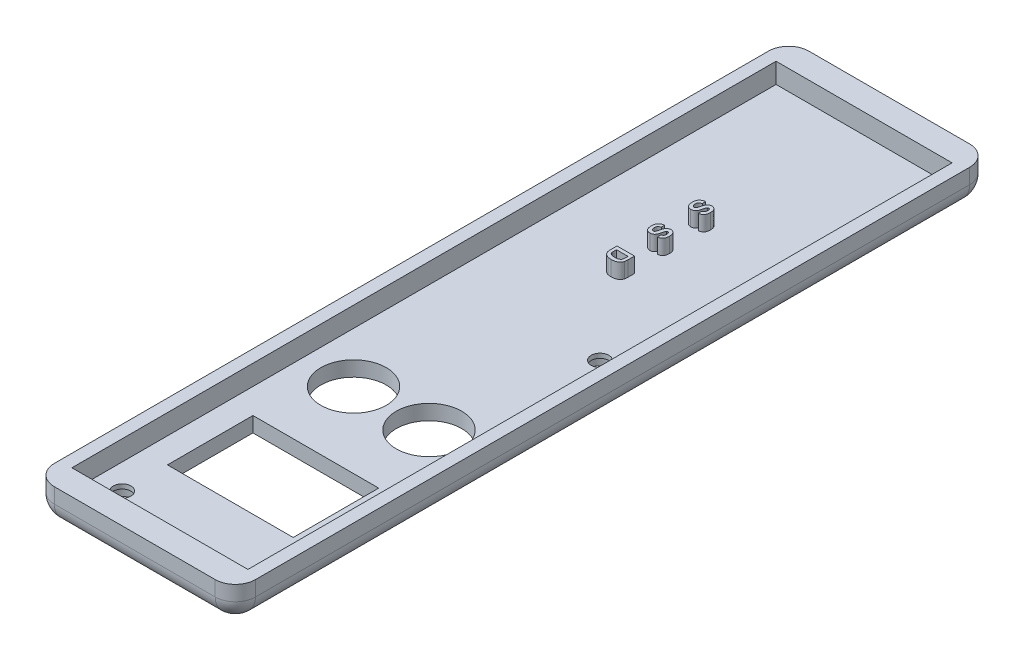
from build123d import *

# Parameters (mm, degrees)
SKETCH1_W           = 40
SKETCH1_H           = 150
BOSS_EXTRUDE1_DEPTH = 3
SKETCH2_W           = 40
SKETCH2_H           = 150
SKETCH2_W_2         = 35
SKETCH2_H_2         = 140
BOSS_EXTRUDE2_DEPTH = 4
FILLET6_R           = 4
CUT_EXTRUDE1_REACH  = 79.936
SKETCH5_R           = 6.5
SKETCH5_W           = 25
SKETCH5_H           = 17
SKETCH7_R           = 2.9
CUT_EXTRUDE7_DEPTH  = 2.1
CUT_EXTRUDE8_REACH  = 79.775
SKETCH8_R           = 1.75
CUT_EXTRUDE9_REACH  = 79.775
SKETCH9_R           = 1.75
BOSS_EXTRUDE3_DEPTH = 3


with BuildPart() as part:
    # Sketch1 → Boss-Extrude1 (new body)
    with BuildSketch(Plane(origin=(0, 0, 0), x_dir=(1, 0, 0), z_dir=(0, 1, 0))):
        Rectangle(SKETCH1_W, SKETCH1_H)
    extrude(amount=BOSS_EXTRUDE1_DEPTH)

    # Sketch2 → Boss-Extrude2 (add)
    with BuildSketch(Plane(origin=(0, 3, 0), x_dir=(1, 0, 0), z_dir=(0, 1, 0))):
        Rectangle(SKETCH2_W, SKETCH2_H)
        Rectangle(SKETCH2_W_2, SKETCH2_H_2, mode=Mode.SUBTRACT)
    extrude(amount=BOSS_EXTRUDE2_DEPTH)

    # Fillet6
    fillet6_edges = [part.edges().sort_by_distance(p)[0] for p in [
        (0, 0, 75),
        (-20, 0, 0),
        (0, 0, -75),
        (20, 0, 0),
        (20, 3.5, 75),
        (-20, 3.5, 75),
        (-20, 3.5, -75),
        (20, 3.5, -75),
    ]]
    fillet(fillet6_edges, radius=FILLET6_R)

    # Sketch5 → Cut-Extrude1 (cut, up to next)
    with BuildSketch(Plane.XZ, mode=Mode.PRIVATE) as cut_extrude1_sk1:
        with Locations(Location((-7.5, 24, 0), (0, 0, 270))):
            Circle(SKETCH5_R)
    cut_extrude1_tool1 = extrude(cut_extrude1_sk1.sketch, amount=-CUT_EXTRUDE1_REACH, mode=Mode.PRIVATE) & part.part
    # Sketch5 → Cut-Extrude1 (cut, up to next)
    with BuildSketch(Plane.XZ, mode=Mode.PRIVATE) as cut_extrude1_sk2:
        with Locations(Location((7.5, 24, 0), (0, 0, 270))):
            Circle(SKETCH5_R)
    cut_extrude1_tool2 = extrude(cut_extrude1_sk2.sketch, amount=-CUT_EXTRUDE1_REACH, mode=Mode.PRIVATE) & part.part
    # Sketch5 → Cut-Extrude1 (cut, up to next)
    with BuildSketch(Plane.XZ, mode=Mode.PRIVATE) as cut_extrude1_sk3:
        with Locations((0, 47.5)):
            Rectangle(SKETCH5_W, SKETCH5_H)
    cut_extrude1_tool3 = extrude(cut_extrude1_sk3.sketch, amount=-CUT_EXTRUDE1_REACH, mode=Mode.PRIVATE) & part.part
    add(cut_extrude1_tool1.solids().sort_by_distance((-7.5, 0, 24))[0], mode=Mode.SUBTRACT)
    add(cut_extrude1_tool2.solids().sort_by_distance((7.5, 0, 24))[0], mode=Mode.SUBTRACT)
    add(cut_extrude1_tool3.solids().sort_by_distance((0, 0, 47.5))[0], mode=Mode.SUBTRACT)

    # Sketch7 → Cut-Extrude7 (cut)
    with BuildSketch(Plane.XZ):
        with Locations(Location((-12.5, 65, 0), (0, 0, 270))):
            Circle(SKETCH7_R)
        with Locations(Location((12.5, -5, 0), (0, 0, 270))):
            Circle(SKETCH7_R)
    extrude(amount=-CUT_EXTRUDE7_DEPTH, mode=Mode.SUBTRACT)

    # Sketch8 → Cut-Extrude8 (cut, up to next)
    with BuildSketch(Plane.XZ.offset(-2.1), mode=Mode.PRIVATE) as cut_extrude8_sk1:
        with Locations(Location((-12.5, 65, 0), (0, 0, 270))):
            Circle(SKETCH8_R)
    cut_extrude8_tool1 = extrude(cut_extrude8_sk1.sketch, amount=-CUT_EXTRUDE8_REACH, mode=Mode.PRIVATE) & part.part
    add(cut_extrude8_tool1.solids().sort_by_distance((-12.5, 2.1, 65))[0], mode=Mode.SUBTRACT)

    # Sketch9 → Cut-Extrude9 (cut, up to next)
    with BuildSketch(Plane.XZ.offset(-2.1), mode=Mode.PRIVATE) as cut_extrude9_sk1:
        with Locations(Location((12.5, -5, 0), (0, 0, 270))):
            Circle(SKETCH9_R)
    cut_extrude9_tool1 = extrude(cut_extrude9_sk1.sketch, amount=-CUT_EXTRUDE9_REACH, mode=Mode.PRIVATE) & part.part
    add(cut_extrude9_tool1.solids().sort_by_distance((12.5, 2.1, -5))[0], mode=Mode.SUBTRACT)

    # Sketch10 → Boss-Extrude3 (add)
    # profile 1 of 3: a face of its own
    with BuildSketch(Plane(origin=(0, 3, 0), x_dir=(1, 0, 0), z_dir=(0, 1, 0))):
        with BuildLine():
            Line((-1.37119391, 39.826822917), (-1.303886218, 39.145332532))
            add(Edge.make_bspline(
                [(-1.303886218, 39.145332532), (-1.331557228, 39.139888819), (-1.385446064, 39.129287278), (-1.462594555, 39.107174228), (-1.534505186, 39.082263778), (-1.600689414, 39.052776819), (-1.661028723, 39.019257221), (-1.715691708, 38.981651855), (-1.764828161, 38.940594367), (-1.808051209, 38.894990303), (-1.846267894, 38.845890332), (-1.878313327, 38.792170952), (-1.906162345, 38.734824179), (-1.92821249, 38.673142381), (-1.946012021, 38.607288458), (-1.958215678, 38.53735479), (-1.96638591, 38.463335056), (-1.966889359, 38.412683553), (-1.967147436, 38.38671875)],
                knots=[0, 0, 0, 0, 1.211294388, 2.358975799, 3.445216481, 4.479134408, 5.468186123, 6.406912785, 7.326263151, 8.214140934, 9.101961924, 9.994088899, 10.89689099, 11.837227727, 12.804317251, 13.824685958, 14.884897803, 16, 16, 16, 16], degree=3))
            add(Edge.make_bspline(
                [(-1.967147436, 38.38671875), (-1.966847327, 38.35935579), (-1.966266548, 38.306402198), (-1.958861689, 38.22962416), (-1.94809058, 38.15781873), (-1.931948858, 38.091249535), (-1.911599241, 38.029773588), (-1.887213982, 37.973539216), (-1.858350031, 37.922316168), (-1.824669757, 37.877065707), (-1.788010302, 37.83691665), (-1.749644217, 37.802078075), (-1.710091389, 37.771917786), (-1.668563029, 37.748015615), (-1.625381531, 37.729775445), (-1.580828232, 37.716065409), (-1.534581741, 37.708459477), (-1.503263604, 37.707240865), (-1.487580128, 37.706630609)],
                knots=[0, 0, 0, 0, 1.412338723, 2.733198818, 3.979115176, 5.158628644, 6.265273535, 7.319005634, 8.318845747, 9.293910864, 10.22497206, 11.12193898, 11.966650322, 12.788379738, 13.58856126, 14.382622932, 15.190050982, 16, 16, 16, 16], degree=3))
            add(Edge.make_bspline(
                [(-1.487580128, 37.706630609), (-1.467851314, 37.707266749), (-1.429258312, 37.70851115), (-1.374067599, 37.723296234), (-1.323139237, 37.745902048), (-1.276317281, 37.778436463), (-1.233043151, 37.822526687), (-1.195471281, 37.880713785), (-1.158230837, 37.950459241), (-1.138913682, 38.003139208), (-1.128605769, 38.03125)],
                knots=[0, 0, 0, 0, 0.904415498, 1.7691945, 2.605565634, 3.454596817, 4.373498053, 5.42498127, 6.625932802, 8, 8, 8, 8], degree=3))
            add(Edge.make_bspline(
                [(-1.128605769, 38.03125), (-1.124523867, 38.043135114), (-1.115299982, 38.069991939), (-1.102626146, 38.115911937), (-1.08596563, 38.17101275), (-1.068887337, 38.236414991), (-1.049140665, 38.311402325), (-1.027476022, 38.396258424), (-1.003627768, 38.490907536), (-0.987187599, 38.557318713), (-0.978565705, 38.592147436)],
                knots=[0, 0, 0, 0, 0.519212209, 1.173265296, 1.967941684, 2.898041418, 3.966265741, 5.172651249, 6.517223256, 8, 8, 8, 8], degree=3))
            add(Edge.make_bspline(
                [(-0.978565705, 38.592147436), (-0.967042438, 38.637597766), (-0.944833523, 38.725194673), (-0.906281511, 38.850264195), (-0.86807547, 38.965448386), (-0.825288734, 39.069361122), (-0.782619091, 39.163881299), (-0.736247488, 39.247050872), (-0.688849112, 39.320504591), (-0.653418814, 39.363218499), (-0.636418269, 39.383713942)],
                knots=[0, 0, 0, 0, 1.293515956, 2.493007092, 3.610516328, 4.640340647, 5.592450897, 6.469945202, 7.265832759, 8, 8, 8, 8], degree=3))
            add(Edge.make_bspline(
                [(-0.636418269, 39.383713942), (-0.612383869, 39.409240168), (-0.56535905, 39.459183839), (-0.487362289, 39.524118971), (-0.405467853, 39.579039504), (-0.320157661, 39.625252056), (-0.229857603, 39.659466091), (-0.136451726, 39.684782307), (-0.038916895, 39.700914971), (0.027481169, 39.702579989), (0.061197917, 39.703425481)],
                knots=[0, 0, 0, 0, 1.062123294, 2.078111211, 3.068480182, 4.047865808, 5.012299681, 5.988502474, 6.978567294, 8, 8, 8, 8], degree=3))
            add(Edge.make_bspline(
                [(0.061197917, 39.703425481), (0.104826213, 39.701767139), (0.191600116, 39.698468802), (0.318875525, 39.668971791), (0.442097014, 39.622373559), (0.539058118, 39.56730693), (0.613496019, 39.515649609), (0.666222195, 39.471981027), (0.715437803, 39.424146959), (0.761185449, 39.372117544), (0.803174086, 39.315584477), (0.84276426, 39.255566203), (0.877519987, 39.190428269), (0.921294721, 39.097814295), (0.966170758, 38.971273942), (1.003208917, 38.806991757), (1.026948515, 38.628358358), (1.029516672, 38.504353519), (1.030849359, 38.440004006)],
                knots=[0, 0, 0, 0, 1.169949165, 2.326954425, 3.488798779, 4.696747735, 5.309491634, 5.920079168, 6.532437411, 7.150459684, 7.777933887, 8.42188263, 9.078905351, 9.758202326, 11.171343328, 12.67210894, 14.273066053, 16, 16, 16, 16], degree=3))
            add(Edge.make_bspline(
                [(1.030849359, 38.440004006), (1.030169176, 38.387153999), (1.028851611, 38.284779537), (1.015104643, 38.136313196), (0.993850424, 37.997743333), (0.963520387, 37.868936415), (0.922538221, 37.750561109), (0.873424996, 37.64203007), (0.816260689, 37.542717645), (0.748177712, 37.455177468), (0.673757055, 37.376841672), (0.59269854, 37.30869837), (0.506138813, 37.24962245), (0.412376125, 37.202274712), (0.313668824, 37.162393844), (0.208399917, 37.13408872), (0.09761975, 37.114598624), (0.021548728, 37.11014741), (-0.017327724, 37.107872596)],
                knots=[0, 0, 0, 0, 1.327349245, 2.571175932, 3.742026754, 4.847068536, 5.890550229, 6.883730842, 7.836307007, 8.761661861, 9.662784209, 10.54607647, 11.417266113, 12.28904906, 13.179783262, 14.087100406, 15.022403705, 16, 16, 16, 16], degree=3))
            Line((-0.017327724, 37.107872596), (-0.049579327, 37.808293269))
            add(Edge.make_bspline(
                [(-0.049579327, 37.808293269), (-0.028010199, 37.812442601), (0.013776926, 37.820481341), (0.073614807, 37.836989141), (0.12943345, 37.855171405), (0.179539, 37.878931385), (0.226108384, 37.903622473), (0.266648705, 37.933673411), (0.303382519, 37.965704609), (0.335581002, 38.001346359), (0.363203956, 38.041246337), (0.38682033, 38.085598467), (0.40750456, 38.134262721), (0.423173432, 38.187775942), (0.435906937, 38.245631904), (0.44475837, 38.308206333), (0.450625581, 38.375388037), (0.450887117, 38.421761484), (0.451021635, 38.445612981)],
                knots=[0, 0, 0, 0, 1.161899681, 2.251015771, 3.283605176, 4.263205498, 5.182215312, 6.067912537, 6.926599353, 7.758594067, 8.602636722, 9.488074832, 10.413801612, 11.395897338, 12.434248429, 13.546711329, 14.738187233, 16, 16, 16, 16], degree=3))
            add(Edge.make_bspline(
                [(0.451021635, 38.445612981), (0.450652805, 38.470401036), (0.449934757, 38.518659171), (0.443368516, 38.58888224), (0.433589995, 38.654886072), (0.420827231, 38.717038796), (0.402061037, 38.774696231), (0.3807163, 38.828548114), (0.355404723, 38.878534548), (0.334956816, 38.908782528), (0.324819712, 38.923778045)],
                knots=[0, 0, 0, 0, 1.183767354, 2.304593972, 3.365504095, 4.37049733, 5.330787512, 6.257395927, 7.136099381, 8, 8, 8, 8], degree=3))
            add(Edge.make_bspline(
                [(0.324819712, 38.923778045), (0.311119114, 38.94073366), (0.284555527, 38.973608281), (0.231873914, 39.008541252), (0.172822086, 39.031150465), (0.130591403, 39.032935968), (0.108874199, 39.033854167)],
                knots=[0, 0, 0, 0, 1.031820115, 2.000558137, 2.971783458, 4, 4, 4, 4], degree=3))
            add(Edge.make_bspline(
                [(0.108874199, 39.033854167), (0.089051731, 39.032760216), (0.049783947, 39.030593127), (-0.00613378, 39.00936908), (-0.058222666, 38.976857336), (-0.08624029, 38.946053238), (-0.100761218, 38.930088141)],
                knots=[0, 0, 0, 0, 0.980288196, 1.941924981, 2.933344249, 4, 4, 4, 4], degree=3))
            add(Edge.make_bspline(
                [(-0.100761218, 38.930088141), (-0.110426739, 38.91720767), (-0.131660368, 38.888911303), (-0.159186748, 38.837143638), (-0.187582614, 38.774348628), (-0.216409138, 38.699444267), (-0.244463846, 38.612603358), (-0.274200619, 38.51432831), (-0.303300281, 38.404052864), (-0.332320909, 38.285336769), (-0.361298246, 38.164684733), (-0.391294935, 38.04940577), (-0.421444196, 37.942271451), (-0.452061318, 37.843524938), (-0.483608667, 37.753101427), (-0.515294077, 37.670851258), (-0.546196437, 37.596523635), (-0.588991836, 37.510250779), (-0.647407147, 37.412940194), (-0.729589954, 37.308863225), (-0.825000328, 37.21918683), (-0.91296602, 37.154736414), (-0.989906042, 37.111915669), (-1.050604529, 37.083059366), (-1.114841579, 37.059007326), (-1.182580302, 37.040485598), (-1.253429433, 37.02486446), (-1.327657108, 37.01366575), (-1.405204739, 37.00739425), (-1.457888053, 37.006610124), (-1.484775641, 37.006209936)],
                knots=[0, 0, 0, 0, 0.521463563, 1.145573417, 1.894966621, 2.756156566, 3.745778802, 4.853318764, 6.084797696, 7.442922524, 8.815764305, 10.107788104, 11.304747736, 12.423968185, 13.459214638, 14.409078785, 15.281660801, 16.067846496, 17.529806441, 18.953423456, 20.352365651, 21.763505927, 22.475939297, 23.20470678, 23.940803866, 24.696453566, 25.479712548, 26.292011568, 27.128306745, 28, 28, 28, 28], degree=3))
            add(Edge.make_bspline(
                [(-1.484775641, 37.006209936), (-1.509337462, 37.006498605), (-1.558352903, 37.007074671), (-1.631184525, 37.015297815), (-1.703200027, 37.027672608), (-1.77389145, 37.046098008), (-1.843447264, 37.069298736), (-1.911827002, 37.097241123), (-1.978478762, 37.13142643), (-2.044185362, 37.169459221), (-2.106990047, 37.212832217), (-2.166382512, 37.260545815), (-2.220714948, 37.313367001), (-2.271883108, 37.369613277), (-2.317789978, 37.430733407), (-2.360253752, 37.495805187), (-2.398866425, 37.56495959), (-2.432421421, 37.638978601), (-2.461832013, 37.717297954), (-2.487963944, 37.800065463), (-2.509251467, 37.88777804), (-2.527754733, 37.979866423), (-2.541613639, 38.076547401), (-2.55113099, 38.177872674), (-2.55780565, 38.283799252), (-2.558526121, 38.356092262), (-2.558894231, 38.393028846)],
                knots=[0, 0, 0, 0, 0.893613517, 1.78329048, 2.664425824, 3.551659064, 4.439422347, 5.332022949, 6.237503295, 7.164000028, 8.093732794, 9.013133136, 9.933674149, 10.849288337, 11.77828132, 12.712672873, 13.676122155, 14.658281659, 15.667910307, 16.719943842, 17.815549004, 18.95172117, 20.137970679, 21.368773839, 22.655630664, 24, 24, 24, 24], degree=3))
            add(Edge.make_bspline(
                [(-2.558894231, 38.393028846), (-2.558241585, 38.446346472), (-2.556973911, 38.549908517), (-2.542734688, 38.700590517), (-2.519148684, 38.841693398), (-2.486296983, 38.97329533), (-2.444518671, 39.095724633), (-2.391752452, 39.208143199), (-2.329674299, 39.311249032), (-2.258836078, 39.405405942), (-2.177254963, 39.488971808), (-2.087777058, 39.564323954), (-1.990032769, 39.631613364), (-1.882546014, 39.688063619), (-1.767109907, 39.736553806), (-1.643089235, 39.776562855), (-1.510344357, 39.807603823), (-1.418297098, 39.820317148), (-1.37119391, 39.826822917)],
                knots=[0, 0, 0, 0, 1.228924412, 2.387014072, 3.485418037, 4.524340195, 5.510961066, 6.463080042, 7.38159832, 8.281436165, 9.173106461, 10.067896996, 10.975061166, 11.903091505, 12.861774172, 13.858582657, 14.904176114, 16, 16, 16, 16], degree=3))
        make_face()
    # profile 2 of 3: a face of its own
    with BuildSketch(Plane(origin=(0, 3, 0), x_dir=(1, 0, 0), z_dir=(0, 1, 0))):
        with BuildLine():
            Line((-1.37119391, 31.692207532), (-1.303886218, 31.010717147))
            add(Edge.make_bspline(
                [(-1.303886218, 31.010717147), (-1.331557228, 31.005273435), (-1.385446064, 30.994671894), (-1.462594555, 30.972558844), (-1.534505186, 30.947648393), (-1.600689414, 30.918161434), (-1.661028723, 30.884641836), (-1.715691708, 30.847036471), (-1.764828161, 30.805978982), (-1.808051209, 30.760374918), (-1.846267894, 30.711274947), (-1.878313327, 30.657555567), (-1.906162345, 30.600208794), (-1.92821249, 30.538526997), (-1.946012021, 30.472673074), (-1.958215678, 30.402739406), (-1.96638591, 30.328719671), (-1.966889359, 30.278068169), (-1.967147436, 30.252103365)],
                knots=[0, 0, 0, 0, 1.211294388, 2.358975799, 3.445216481, 4.479134408, 5.468186123, 6.406912785, 7.326263151, 8.214140934, 9.101961924, 9.994088899, 10.89689099, 11.837227727, 12.804317251, 13.824685958, 14.884897803, 16, 16, 16, 16], degree=3))
            add(Edge.make_bspline(
                [(-1.967147436, 30.252103365), (-1.966847327, 30.224740406), (-1.966266548, 30.171786813), (-1.958861689, 30.095008775), (-1.94809058, 30.023203345), (-1.931948858, 29.956634151), (-1.911599241, 29.895158203), (-1.887213982, 29.838923831), (-1.858350031, 29.787700783), (-1.824669757, 29.742450322), (-1.788010302, 29.702301265), (-1.749644217, 29.667462691), (-1.710091389, 29.637302401), (-1.668563029, 29.61340023), (-1.625381531, 29.59516006), (-1.580828232, 29.581450024), (-1.534581741, 29.573844092), (-1.503263604, 29.57262548), (-1.487580128, 29.572015224)],
                knots=[0, 0, 0, 0, 1.412338723, 2.733198818, 3.979115176, 5.158628644, 6.265273535, 7.319005634, 8.318845747, 9.293910864, 10.22497206, 11.12193898, 11.966650322, 12.788379738, 13.58856126, 14.382622932, 15.190050982, 16, 16, 16, 16], degree=3))
            add(Edge.make_bspline(
                [(-1.487580128, 29.572015224), (-1.467851314, 29.572651364), (-1.429258312, 29.573895765), (-1.374067599, 29.58868085), (-1.323139237, 29.611286663), (-1.276317281, 29.643821079), (-1.233043151, 29.687911303), (-1.195471281, 29.7460984), (-1.158230837, 29.815843856), (-1.138913682, 29.868523824), (-1.128605769, 29.896634615)],
                knots=[0, 0, 0, 0, 0.904415498, 1.7691945, 2.605565634, 3.454596817, 4.373498053, 5.42498127, 6.625932802, 8, 8, 8, 8], degree=3))
            add(Edge.make_bspline(
                [(-1.128605769, 29.896634615), (-1.124523867, 29.908519729), (-1.115299982, 29.935376554), (-1.102626146, 29.981296553), (-1.08596563, 30.036397365), (-1.068887337, 30.101799606), (-1.049140665, 30.176786941), (-1.027476022, 30.26164304), (-1.003627768, 30.356292152), (-0.987187599, 30.422703328), (-0.978565705, 30.457532051)],
                knots=[0, 0, 0, 0, 0.519212209, 1.173265296, 1.967941684, 2.898041418, 3.966265741, 5.172651249, 6.517223256, 8, 8, 8, 8], degree=3))
            add(Edge.make_bspline(
                [(-0.978565705, 30.457532051), (-0.967042438, 30.502982382), (-0.944833523, 30.590579288), (-0.906281511, 30.715648811), (-0.86807547, 30.830833002), (-0.825288734, 30.934745737), (-0.782619091, 31.029265914), (-0.736247488, 31.112435488), (-0.688849112, 31.185889206), (-0.653418814, 31.228603114), (-0.636418269, 31.249098558)],
                knots=[0, 0, 0, 0, 1.293515956, 2.493007092, 3.610516328, 4.640340647, 5.592450897, 6.469945202, 7.265832759, 8, 8, 8, 8], degree=3))
            add(Edge.make_bspline(
                [(-0.636418269, 31.249098558), (-0.612383869, 31.274624784), (-0.56535905, 31.324568455), (-0.487362289, 31.389503586), (-0.405467853, 31.444424119), (-0.320157661, 31.490636672), (-0.229857603, 31.524850707), (-0.136451726, 31.550166922), (-0.038916895, 31.566299586), (0.027481169, 31.567964605), (0.061197917, 31.568810096)],
                knots=[0, 0, 0, 0, 1.062123294, 2.078111211, 3.068480182, 4.047865808, 5.012299681, 5.988502474, 6.978567294, 8, 8, 8, 8], degree=3))
            add(Edge.make_bspline(
                [(0.061197917, 31.568810096), (0.104826213, 31.567151754), (0.191600116, 31.563853417), (0.318875525, 31.534356406), (0.442097014, 31.487758174), (0.539058118, 31.432691546), (0.613496019, 31.381034225), (0.666222195, 31.337365642), (0.715437803, 31.289531575), (0.761185449, 31.237502159), (0.803174086, 31.180969092), (0.84276426, 31.120950818), (0.877519987, 31.055812884), (0.921294721, 30.96319891), (0.966170758, 30.836658558), (1.003208917, 30.672376372), (1.026948515, 30.493742974), (1.029516672, 30.369738134), (1.030849359, 30.305388622)],
                knots=[0, 0, 0, 0, 1.169949165, 2.326954425, 3.488798779, 4.696747735, 5.309491634, 5.920079168, 6.532437411, 7.150459684, 7.777933887, 8.42188263, 9.078905351, 9.758202326, 11.171343328, 12.67210894, 14.273066053, 16, 16, 16, 16], degree=3))
            add(Edge.make_bspline(
                [(1.030849359, 30.305388622), (1.030169176, 30.252538615), (1.028851611, 30.150164152), (1.015104643, 30.001697812), (0.993850424, 29.863127948), (0.963520387, 29.73432103), (0.922538221, 29.615945724), (0.873424996, 29.507414685), (0.816260689, 29.40810226), (0.748177712, 29.320562084), (0.673757055, 29.242226287), (0.59269854, 29.174082986), (0.506138813, 29.115007065), (0.412376125, 29.067659328), (0.313668824, 29.027778459), (0.208399917, 28.999473335), (0.09761975, 28.979983239), (0.021548728, 28.975532025), (-0.017327724, 28.973257212)],
                knots=[0, 0, 0, 0, 1.327349245, 2.571175932, 3.742026754, 4.847068536, 5.890550229, 6.883730842, 7.836307007, 8.761661861, 9.662784209, 10.54607647, 11.417266113, 12.28904906, 13.179783262, 14.087100406, 15.022403705, 16, 16, 16, 16], degree=3))
            Line((-0.017327724, 28.973257212), (-0.049579327, 29.673677885))
            add(Edge.make_bspline(
                [(-0.049579327, 29.673677885), (-0.028010199, 29.677827216), (0.013776926, 29.685865957), (0.073614807, 29.702373757), (0.12943345, 29.72055602), (0.179539, 29.744316001), (0.226108384, 29.769007088), (0.266648705, 29.799058027), (0.303382519, 29.831089224), (0.335581002, 29.866730974), (0.363203956, 29.906630952), (0.38682033, 29.950983082), (0.40750456, 29.999647336), (0.423173432, 30.053160558), (0.435906937, 30.111016519), (0.44475837, 30.173590949), (0.450625581, 30.240772652), (0.450887117, 30.287146099), (0.451021635, 30.310997596)],
                knots=[0, 0, 0, 0, 1.161899681, 2.251015771, 3.283605176, 4.263205498, 5.182215312, 6.067912537, 6.926599353, 7.758594067, 8.602636722, 9.488074832, 10.413801612, 11.395897338, 12.434248429, 13.546711329, 14.738187233, 16, 16, 16, 16], degree=3))
            add(Edge.make_bspline(
                [(0.451021635, 30.310997596), (0.450652805, 30.335785652), (0.449934757, 30.384043786), (0.443368516, 30.454266855), (0.433589995, 30.520270687), (0.420827231, 30.582423411), (0.402061037, 30.640080846), (0.3807163, 30.693932729), (0.355404723, 30.743919163), (0.334956816, 30.774167143), (0.324819712, 30.78916266)],
                knots=[0, 0, 0, 0, 1.183767354, 2.304593972, 3.365504095, 4.37049733, 5.330787512, 6.257395927, 7.136099381, 8, 8, 8, 8], degree=3))
            add(Edge.make_bspline(
                [(0.324819712, 30.78916266), (0.311119114, 30.806118276), (0.284555527, 30.838992896), (0.231873914, 30.873925868), (0.172822086, 30.89653508), (0.130591403, 30.898320584), (0.108874199, 30.899238782)],
                knots=[0, 0, 0, 0, 1.031820115, 2.000558137, 2.971783458, 4, 4, 4, 4], degree=3))
            add(Edge.make_bspline(
                [(0.108874199, 30.899238782), (0.089051731, 30.898144831), (0.049783947, 30.895977743), (-0.00613378, 30.874753696), (-0.058222666, 30.842241952), (-0.08624029, 30.811437854), (-0.100761218, 30.795472756)],
                knots=[0, 0, 0, 0, 0.980288196, 1.941924981, 2.933344249, 4, 4, 4, 4], degree=3))
            add(Edge.make_bspline(
                [(-0.100761218, 30.795472756), (-0.110426739, 30.782592286), (-0.131660368, 30.754295918), (-0.159186748, 30.702528253), (-0.187582614, 30.639733244), (-0.216409138, 30.564828882), (-0.244463846, 30.477987974), (-0.274200619, 30.379712925), (-0.303300281, 30.269437479), (-0.332320909, 30.150721384), (-0.361298246, 30.030069349), (-0.391294935, 29.914790386), (-0.421444196, 29.807656066), (-0.452061318, 29.708909553), (-0.483608667, 29.618486042), (-0.515294077, 29.536235873), (-0.546196437, 29.461908251), (-0.588991836, 29.375635395), (-0.647407147, 29.27832481), (-0.729589954, 29.17424784), (-0.825000328, 29.084571445), (-0.91296602, 29.02012103), (-0.989906042, 28.977300285), (-1.050604529, 28.948443982), (-1.114841579, 28.924391941), (-1.182580302, 28.905870214), (-1.253429433, 28.890249075), (-1.327657108, 28.879050365), (-1.405204739, 28.872778866), (-1.457888053, 28.87199474), (-1.484775641, 28.871594551)],
                knots=[0, 0, 0, 0, 0.521463563, 1.145573417, 1.894966621, 2.756156566, 3.745778802, 4.853318764, 6.084797696, 7.442922524, 8.815764305, 10.107788104, 11.304747736, 12.423968185, 13.459214638, 14.409078785, 15.281660801, 16.067846496, 17.529806441, 18.953423456, 20.352365651, 21.763505927, 22.475939297, 23.20470678, 23.940803866, 24.696453566, 25.479712548, 26.292011568, 27.128306745, 28, 28, 28, 28], degree=3))
            add(Edge.make_bspline(
                [(-1.484775641, 28.871594551), (-1.509337462, 28.87188322), (-1.558352903, 28.872459287), (-1.631184525, 28.880682431), (-1.703200027, 28.893057223), (-1.77389145, 28.911482623), (-1.843447264, 28.934683351), (-1.911827002, 28.962625739), (-1.978478762, 28.996811046), (-2.044185362, 29.034843836), (-2.106990047, 29.078216833), (-2.166382512, 29.125930431), (-2.220714948, 29.178751617), (-2.271883108, 29.234997893), (-2.317789978, 29.296118022), (-2.360253752, 29.361189802), (-2.398866425, 29.430344206), (-2.432421421, 29.504363216), (-2.461832013, 29.582682569), (-2.487963944, 29.665450079), (-2.509251467, 29.753162656), (-2.527754733, 29.845251038), (-2.541613639, 29.941932016), (-2.55113099, 30.04325729), (-2.55780565, 30.149183867), (-2.558526121, 30.221476877), (-2.558894231, 30.258413462)],
                knots=[0, 0, 0, 0, 0.893613517, 1.78329048, 2.664425824, 3.551659064, 4.439422347, 5.332022949, 6.237503295, 7.164000028, 8.093732794, 9.013133136, 9.933674149, 10.849288337, 11.77828132, 12.712672873, 13.676122155, 14.658281659, 15.667910307, 16.719943842, 17.815549004, 18.95172117, 20.137970679, 21.368773839, 22.655630664, 24, 24, 24, 24], degree=3))
            add(Edge.make_bspline(
                [(-2.558894231, 30.258413462), (-2.558241585, 30.311731088), (-2.556973911, 30.415293132), (-2.542734688, 30.565975133), (-2.519148684, 30.707078013), (-2.486296983, 30.838679945), (-2.444518671, 30.961109248), (-2.391752452, 31.073527815), (-2.329674299, 31.176633647), (-2.258836078, 31.270790557), (-2.177254963, 31.354356424), (-2.087777058, 31.429708569), (-1.990032769, 31.496997979), (-1.882546014, 31.553448234), (-1.767109907, 31.601938422), (-1.643089235, 31.641947471), (-1.510344357, 31.672988439), (-1.418297098, 31.685701764), (-1.37119391, 31.692207532)],
                knots=[0, 0, 0, 0, 1.228924412, 2.387014072, 3.485418037, 4.524340195, 5.510961066, 6.463080042, 7.38159832, 8.281436165, 9.173106461, 10.067896996, 10.975061166, 11.903091505, 12.861774172, 13.858582657, 14.904176114, 16, 16, 16, 16], degree=3))
        make_face()
    # profile 3 of 3: a face of its own
    with BuildSketch(Plane(origin=(0, 3, 0), x_dir=(1, 0, 0), z_dir=(0, 1, 0))):
        with BuildLine():
            Line((0.969851763, 23.386518429), (0.971955128, 22.106971154))
            add(Edge.make_bspline(
                [(0.971955128, 22.106971154), (0.971853602, 22.071914699), (0.971656605, 22.00389265), (0.96920459, 21.905204268), (0.963126507, 21.81291327), (0.95656621, 21.727060755), (0.947457734, 21.647540611), (0.936295087, 21.574564172), (0.923341964, 21.507781111), (0.912117708, 21.465858637), (0.906750801, 21.445813301)],
                knots=[0, 0, 0, 0, 1.262747888, 2.450182054, 3.555011794, 4.593858421, 5.551381641, 6.437167574, 7.252727759, 8, 8, 8, 8], degree=3))
            add(Edge.make_bspline(
                [(0.906750801, 21.445813301), (0.898886101, 21.420699133), (0.883276759, 21.370854182), (0.854424836, 21.298361046), (0.820596551, 21.228952324), (0.782746662, 21.162144555), (0.740315778, 21.098170609), (0.694404868, 21.036458817), (0.643317082, 20.977868189), (0.56966493, 20.903409763), (0.468153604, 20.817393466), (0.333614007, 20.727342831), (0.185758722, 20.650810845), (0.053380866, 20.597846016), (-0.059686297, 20.56269699), (-0.150269003, 20.53962705), (-0.245518235, 20.52015435), (-0.345621345, 20.503946639), (-0.450427746, 20.491525828), (-0.560335931, 20.48243375), (-0.674921143, 20.476778006), (-0.753031712, 20.475904905), (-0.792768429, 20.475460737)],
                knots=[0, 0, 0, 0, 0.748962388, 1.486491382, 2.218448358, 2.945430104, 3.670583116, 4.402388907, 5.133377765, 5.88136446, 7.382300024, 8.911933133, 10.480099345, 12.113285679, 12.963384968, 13.849229533, 14.772984256, 15.729990752, 16.735067062, 17.776498084, 18.868851324, 20, 20, 20, 20], degree=3))
            add(Edge.make_bspline(
                [(-0.792768429, 20.475460737), (-0.86177353, 20.476487294), (-0.995175325, 20.478471849), (-1.18747159, 20.498841001), (-1.365894391, 20.529181317), (-1.477112906, 20.56335496), (-1.531049679, 20.579927885)],
                knots=[0, 0, 0, 0, 1.105451799, 2.137077599, 3.096553096, 4, 4, 4, 4], degree=3))
            add(Edge.make_bspline(
                [(-1.531049679, 20.579927885), (-1.561991859, 20.591132783), (-1.62297341, 20.61321565), (-1.711544611, 20.650120137), (-1.79503336, 20.691562242), (-1.873606888, 20.736767154), (-1.948564144, 20.784224185), (-2.018202002, 20.836246456), (-2.084345901, 20.890888612), (-2.124494083, 20.930868259), (-2.14453125, 20.950821314)],
                knots=[0, 0, 0, 0, 1.091518548, 2.151189607, 3.180860488, 4.180863212, 5.157147081, 6.121539711, 7.062497446, 8, 8, 8, 8], degree=3))
            add(Edge.make_bspline(
                [(-2.14453125, 20.950821314), (-2.173540386, 20.983026797), (-2.233144692, 21.049198549), (-2.306387162, 21.166090787), (-2.372036146, 21.297365611), (-2.405041477, 21.392776955), (-2.422175481, 21.442307692)],
                knots=[0, 0, 0, 0, 0.912128846, 1.874127006, 2.896398997, 4, 4, 4, 4], degree=3))
            add(Edge.make_bspline(
                [(-2.422175481, 21.442307692), (-2.428301454, 21.462331965), (-2.440948856, 21.503673156), (-2.454989974, 21.569475703), (-2.468597315, 21.639722713), (-2.479067058, 21.715082367), (-2.486244534, 21.79514261), (-2.493022722, 21.879944076), (-2.496214947, 21.969760911), (-2.496862979, 22.031248457), (-2.497195513, 22.062800481)],
                knots=[0, 0, 0, 0, 0.800809033, 1.653313468, 2.572254802, 3.538360292, 4.562435764, 5.647356755, 6.79275302, 8, 8, 8, 8], degree=3))
            Line((-2.497195513, 22.062800481), (-2.499298878, 23.380208333))
            Line((-2.499298878, 23.380208333), (0.969851763, 23.386518429))
        make_face()
        with BuildLine():
            Line((0.384415064, 22.684695513), (-1.913161058, 22.680488782))
            Line((-1.913161058, 22.680488782), (-1.912459936, 22.158153045))
            add(Edge.make_bspline(
                [(-1.912459936, 22.158153045), (-1.912294291, 22.112555834), (-1.911988245, 22.028310147), (-1.90398558, 21.912210362), (-1.896464715, 21.816018292), (-1.884217952, 21.75960472), (-1.87880609, 21.734675481)],
                knots=[0, 0, 0, 0, 1.284989726, 2.374154883, 3.281536712, 4, 4, 4, 4], degree=3))
            add(Edge.make_bspline(
                [(-1.87880609, 21.734675481), (-1.870992918, 21.707364537), (-1.855746558, 21.654070886), (-1.823230465, 21.579048477), (-1.783088126, 21.511541168), (-1.735299866, 21.449436188), (-1.673489144, 21.394964808), (-1.596527126, 21.346871259), (-1.503965422, 21.303592599), (-1.415774762, 21.273348755), (-1.336882398, 21.251139353), (-1.270248691, 21.237608854), (-1.198692664, 21.22566025), (-1.121975081, 21.215908823), (-1.039895936, 21.208256153), (-0.952448433, 21.20282386), (-0.859642005, 21.199035371), (-0.796044395, 21.199024185), (-0.763321314, 21.199018429)],
                knots=[0, 0, 0, 0, 1.01072857, 1.972301552, 2.901386088, 3.802047799, 4.750897597, 5.817399855, 7.023464074, 8.381499132, 9.132524548, 9.940409966, 10.800925815, 11.715436162, 12.69336202, 13.735695582, 14.834940234, 16, 16, 16, 16], degree=3))
            add(Edge.make_bspline(
                [(-0.763321314, 21.199018429), (-0.730833221, 21.199328304), (-0.667707731, 21.199930402), (-0.576055018, 21.203397), (-0.490034694, 21.209109951), (-0.409949026, 21.216190913), (-0.335741374, 21.227396847), (-0.267205381, 21.238506253), (-0.204555512, 21.253470029), (-0.130242391, 21.27536996), (-0.046249198, 21.307964805), (0.044765979, 21.353662233), (0.123607191, 21.407339608), (0.190963205, 21.46848116), (0.24676077, 21.538094936), (0.292763908, 21.615775195), (0.329947091, 21.701629706), (0.345106462, 21.763373363), (0.352864583, 21.794971955)],
                knots=[0, 0, 0, 0, 1.125598111, 2.187076138, 3.177030444, 4.112434319, 4.971249802, 5.776605265, 6.517026194, 7.201066123, 8.459646792, 9.632928307, 10.722176625, 11.753772558, 12.772996757, 13.800581037, 14.874401889, 16, 16, 16, 16], degree=3))
            add(Edge.make_bspline(
                [(0.352864583, 21.794971955), (0.355612571, 21.808732225), (0.361637455, 21.838901223), (0.367331655, 21.889089956), (0.373159424, 21.947724711), (0.376986051, 22.01533422), (0.380492821, 22.091758269), (0.383371232, 22.177063664), (0.384714443, 22.271029412), (0.384517665, 22.33647143), (0.384415064, 22.370592949)],
                knots=[0, 0, 0, 0, 0.583147964, 1.27853517, 2.098408778, 3.033006507, 4.093211508, 5.27925344, 6.581400622, 8, 8, 8, 8], degree=3))
            Line((0.384415064, 22.370592949), (0.384415064, 22.684695513))
        make_face(mode=Mode.SUBTRACT)
    extrude(amount=BOSS_EXTRUDE3_DEPTH)


solid = part.part
